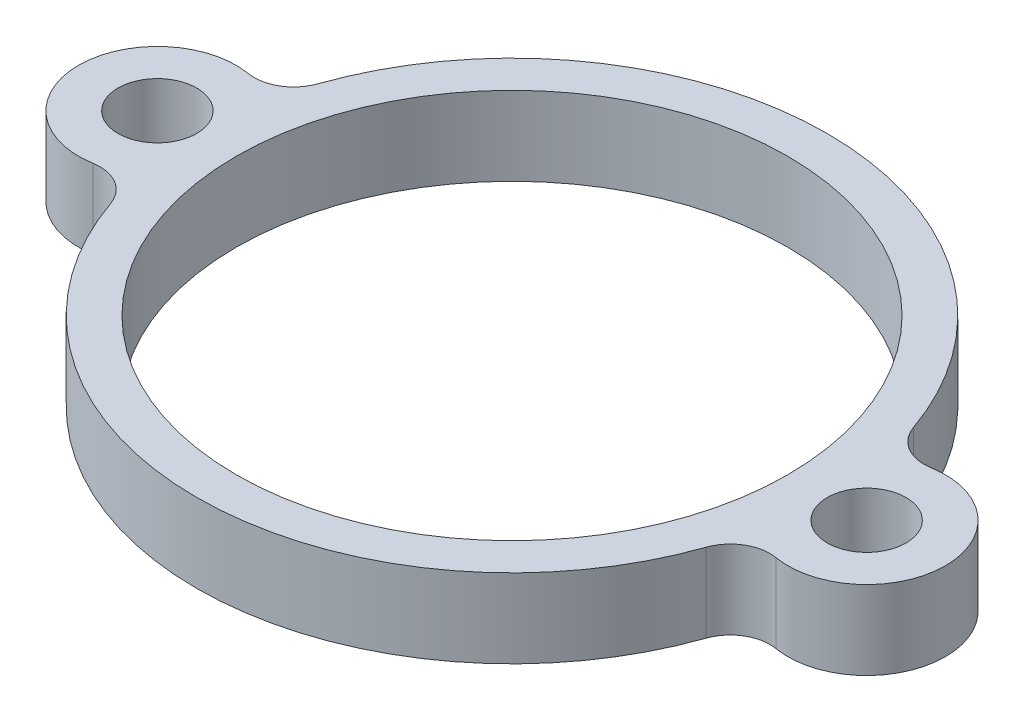
from build123d import *

# Parameters (mm, degrees)
SKETCH1_R           = 35
SKETCH1_R_2         = 5
BOSS_EXTRUDE1_DEPTH = 10


with BuildPart() as part:
    # Sketch1 → Boss-Extrude1 (new body)
    with BuildSketch(Plane(origin=(0, 0, 0), x_dir=(1, 0, 0), z_dir=(0, 1, 0))):
        with BuildLine():
            ThreePointArc((-37.777777778, -13.146843962), (0, -40), (37.777777778, -13.146843962))
            ThreePointArc((37.777777778, -13.146843962), (39.954124614, -10.486884629), (43.333333333, -9.860132972))
            ThreePointArc((43.333333333, -9.860132972), (55, 0), (43.333333333, 9.860132972))
            ThreePointArc((43.333333333, 9.860132972), (39.954124614, 10.486884629), (37.777777778, 13.146843962))
            ThreePointArc((37.777777778, 13.146843962), (0, 40), (-37.777777778, 13.146843962))
            ThreePointArc((-37.777777778, 13.146843962), (-39.954124614, 10.486884629), (-43.333333333, 9.860132972))
            ThreePointArc((-43.333333333, 9.860132972), (-55, 0), (-43.333333333, -9.860132972))
            ThreePointArc((-43.333333333, -9.860132972), (-39.954124614, -10.486884629), (-37.777777778, -13.146843962))
        make_face()
        with Locations(Location((0, 0, 0), (0, 0, 270))):
            Circle(SKETCH1_R, mode=Mode.SUBTRACT)
        with Locations(Location((-45, 0, 0), (0, 0, 270))):
            Circle(SKETCH1_R_2, mode=Mode.SUBTRACT)
        with Locations(Location((45, 0, 0), (0, 0, 270))):
            Circle(SKETCH1_R_2, mode=Mode.SUBTRACT)
    extrude(amount=BOSS_EXTRUDE1_DEPTH)


solid = part.part
